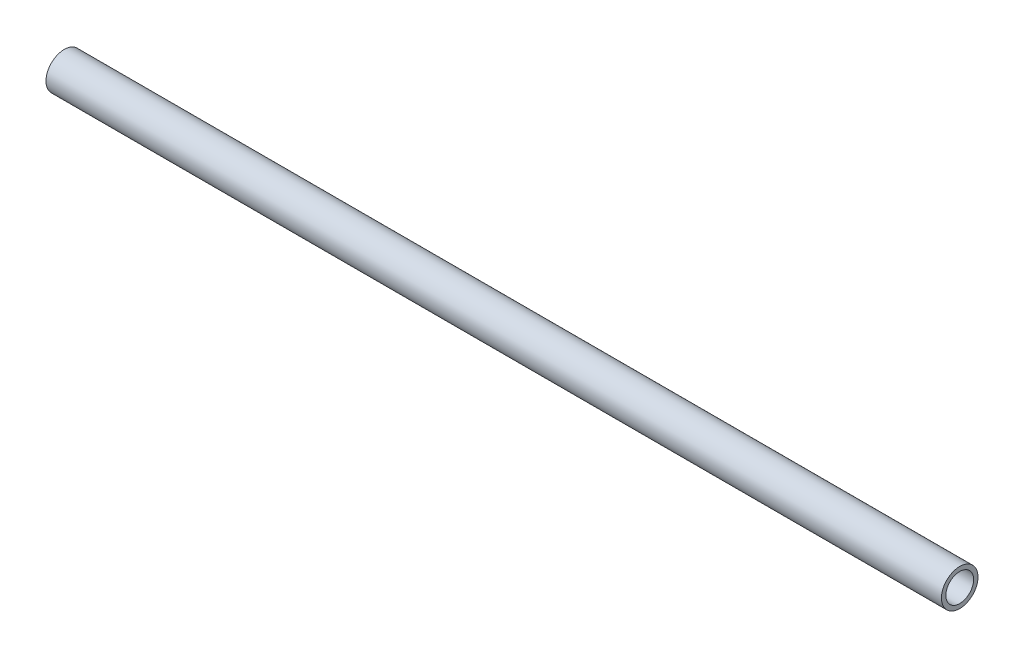
from build123d import *

# Parameters (mm, degrees)
SKETCH1_R           = 12.7
SKETCH1_R_2         = 9.652
BOSS_EXTRUDE1_DEPTH = 622.3


with BuildPart() as part:
    # Sketch1 → Boss-Extrude1 (new body)
    with BuildSketch(Plane(origin=(0, 0, 0), x_dir=(0, 0, -1), z_dir=(1, 0, 0))):
        Circle(SKETCH1_R)
        Circle(SKETCH1_R_2, mode=Mode.SUBTRACT)
    extrude(amount=BOSS_EXTRUDE1_DEPTH)


solid = part.part
